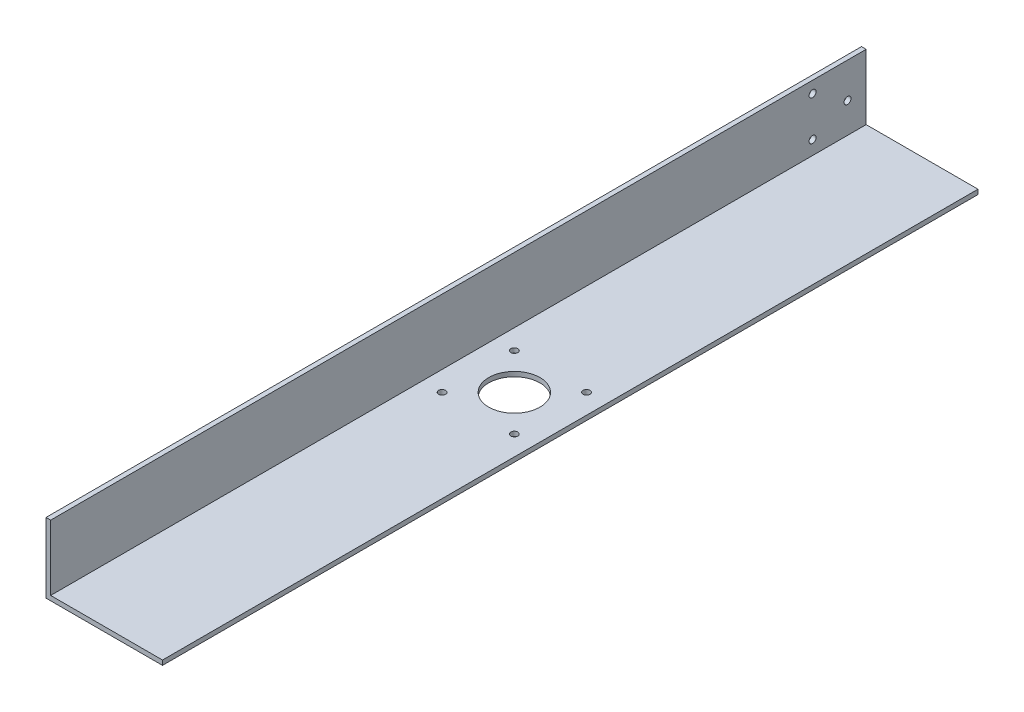
from build123d import *

# Parameters (mm, degrees)
BOSS_EXTRUDE1_DEPTH      = 350
SKETCH7_R                = 10.999999996
CUT_EXTRUDE1_DEPTH       = 355.660400947
SKETCH8_R                = 1.499999996
CUT_EXTRUDE2_DEPTH       = 355.660400947
F_3_0_3_DIAMETER_HOLE1_D = 3


with BuildPart() as part:
    # Sketch1 → Boss-Extrude1 (new body)
    with BuildSketch(Plane.XY):
        Polygon((0, 0), (0, 30), (2, 30), (2, 2), (50, 2), (50, 0), align=None)
    extrude(amount=BOSS_EXTRUDE1_DEPTH)

    # Sketch7 → Cut-Extrude1 (cut, through all)
    with BuildSketch(Plane(origin=(0, 2, 0), x_dir=(1, 0, 0), z_dir=(0, 1, 0))):
        with Locations(Location((26, -175, 0), (0, 0, 90))):
            Circle(SKETCH7_R)
    extrude(amount=-CUT_EXTRUDE1_DEPTH, mode=Mode.SUBTRACT)

    # Sketch8 → Cut-Extrude2 (cut, through all)
    with BuildSketch(Plane(origin=(0, 2, 0), x_dir=(1, 0, 0), z_dir=(0, 1, 0))):
        with Locations(Location((41.5, -190.5, 0), (0, 0, 270))):
            Circle(SKETCH8_R)
        with Locations(Location((41.5, -159.5, 0), (0, 0, 270))):
            Circle(SKETCH8_R)
        with Locations(Location((10.5, -190.5, 0), (0, 0, 270))):
            Circle(SKETCH8_R)
        with Locations(Location((10.5, -159.5, 0), (0, 0, 270))):
            Circle(SKETCH8_R)
    extrude(amount=-CUT_EXTRUDE2_DEPTH, mode=Mode.SUBTRACT)

    # Ø3.0 (3) Diameter Hole1 (through all)
    with Locations(Plane(origin=(0, 182.32004832, 128.861996081), x_dir=(0, 0, -1), z_dir=(-1, 0, 0))):
        with Locations((105.861996081, 174.32004832), (105.861996081, 157.32004832), (120.861996081, 167.32004832)):
            Hole(F_3_0_3_DIAMETER_HOLE1_D / 2)


solid = part.part
